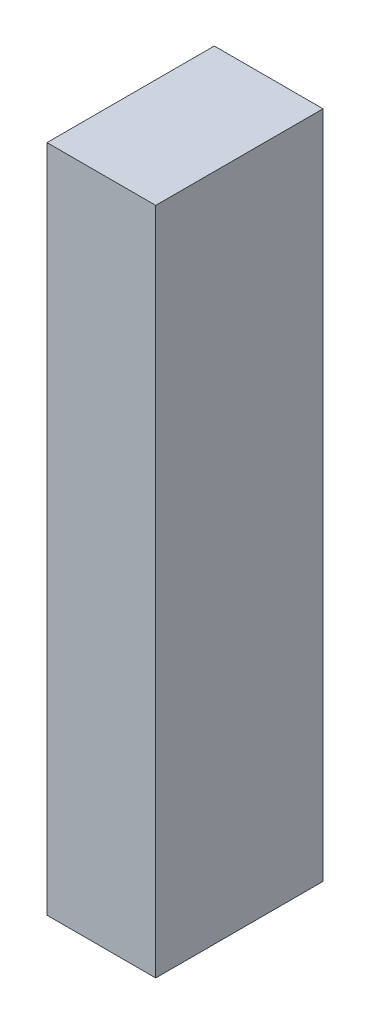
from build123d import *

# Parameters (mm, degrees)
SKETCH1_W           = 65
SKETCH1_H           = 100
BOSS_EXTRUDE1_DEPTH = 400


with BuildPart() as part:
    # Sketch1 → Boss-Extrude1 (new body)
    with BuildSketch(Plane(origin=(0, 0, 0), x_dir=(1, 0, 0), z_dir=(0, 1, 0))):
        Rectangle(SKETCH1_W, SKETCH1_H)
    extrude(amount=BOSS_EXTRUDE1_DEPTH)


solid = part.part
